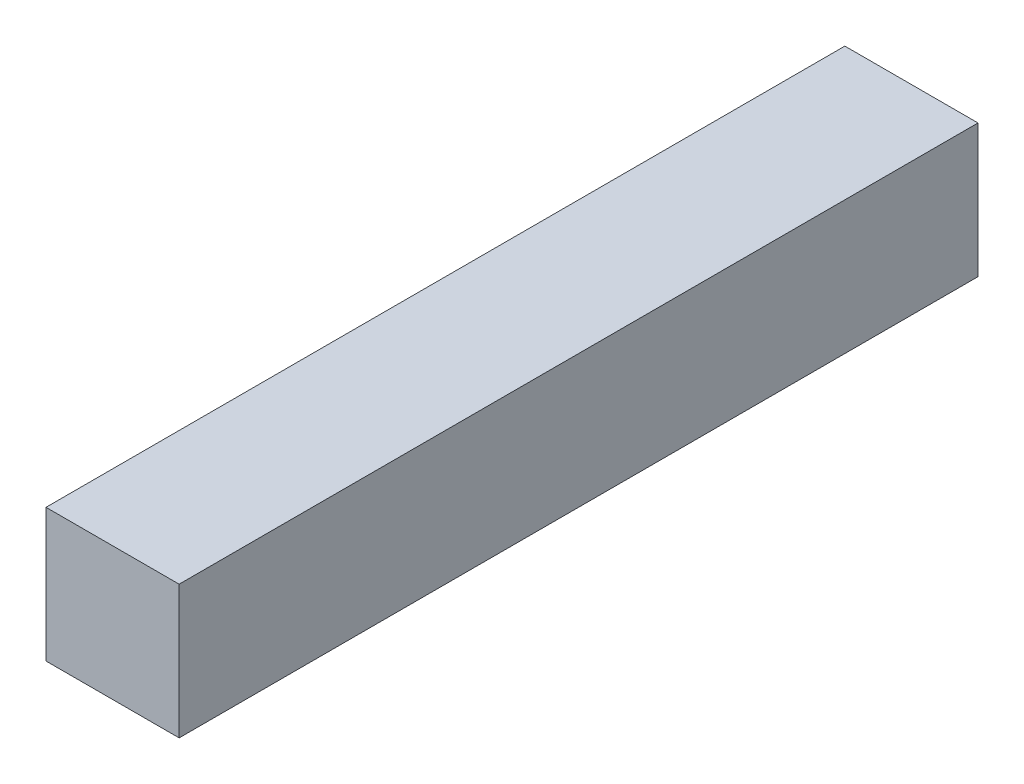
from build123d import *

# Parameters (mm, degrees)
SKETCH_1_W      = 20
SKETCH_1_H      = 20
EXTRUDE_1_DEPTH = 120


with BuildPart() as part:
    # 草圖1 → 填料-伸長1 (new body)
    with BuildSketch(Plane.XY):
        Rectangle(SKETCH_1_W, SKETCH_1_H)
    extrude(amount=EXTRUDE_1_DEPTH)


solid = part.part
